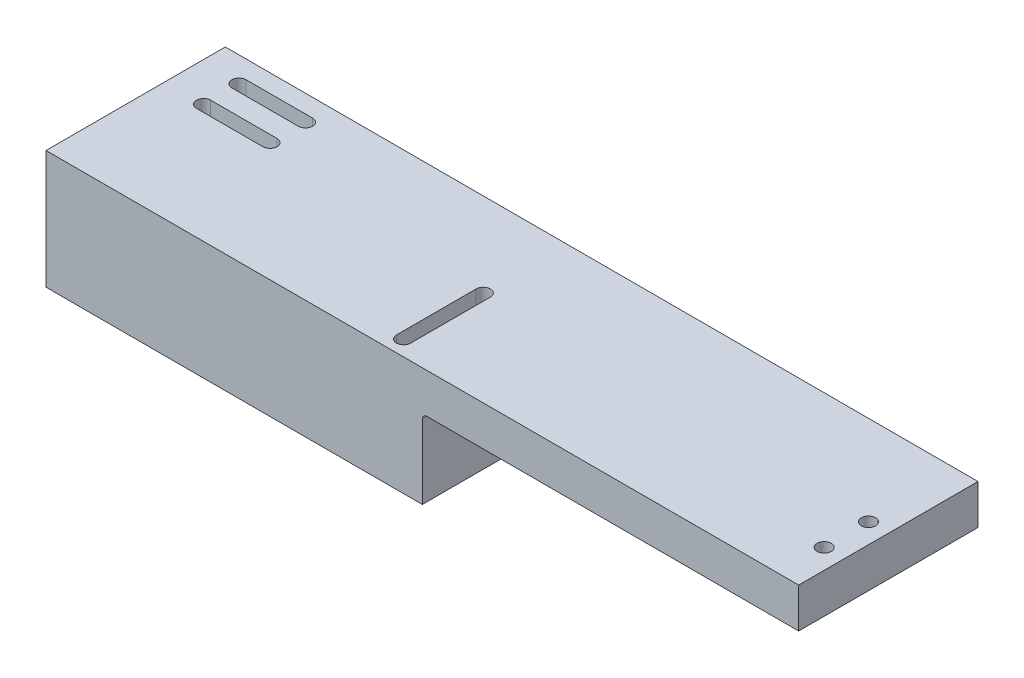
from build123d import *

# Parameters (mm, degrees)
SKETCH1_W           = 170
SKETCH1_H           = 40.5
BOSS_EXTRUDE1_DEPTH = 9
SKETCH2_W           = 85
SKETCH2_H           = 40.5
BOSS_EXTRUDE2_DEPTH = 17.745
SKETCH3_R           = 1.6
CUT_EXTRUDE1_DEPTH  = 92.380290681
FILLET1_R           = 1


with BuildPart() as part:
    # Sketch1 → Boss-Extrude1 (new body)
    with BuildSketch(Plane(origin=(0, 0, 0), x_dir=(1, 0, 0), z_dir=(0, 1, 0))):
        Rectangle(SKETCH1_W, SKETCH1_H)
    extrude(amount=BOSS_EXTRUDE1_DEPTH)

    # Sketch2 → Boss-Extrude2 (add)
    with BuildSketch(Plane.XZ):
        with Locations((-42.5, 0)):
            Rectangle(SKETCH2_W, SKETCH2_H)
    extrude(amount=BOSS_EXTRUDE2_DEPTH)

    # Sketch3 → Cut-Extrude1 (cut, through all)
    with BuildSketch(Plane(origin=(0, 9, 0), x_dir=(1, 0, 0), z_dir=(0, 1, 0))):
        with Locations(Location((80.508679868, 0, 0), (0, 0, 270))):
            Circle(SKETCH3_R)
        with Locations(Location((80.508679868, -10, 0), (0, 0, 270))):
            Circle(SKETCH3_R)
        with BuildLine():
            Line((-76.241320132, 8.185093605), (-61.241320132, 8.185093605))
            ThreePointArc((-61.241320132, 8.185093605), (-59.641320132, 6.585093605), (-61.241320132, 4.985093605))
            Line((-61.241320132, 4.985093605), (-76.241320132, 4.985093605))
            ThreePointArc((-76.241320132, 4.985093605), (-77.841320132, 6.585093605), (-76.241320132, 8.185093605))
        make_face()
        with BuildLine():
            Line((-61.241320132, 12.985093605), (-76.241320132, 12.985093605))
            ThreePointArc((-76.241320132, 12.985093605), (-77.841320132, 14.585093605), (-76.241320132, 16.185093605))
            Line((-76.241320132, 16.185093605), (-61.241320132, 16.185093605))
            ThreePointArc((-61.241320132, 16.185093605), (-59.641320132, 14.585093605), (-61.241320132, 12.985093605))
        make_face()
        with BuildLine():
            Line((-6.141320132, 1.249202664), (-6.141320132, -16.750797336))
            ThreePointArc((-6.141320132, -16.750797336), (-7.741320132, -18.350797336), (-9.341320132, -16.750797336))
            Line((-9.341320132, -16.750797336), (-9.341320132, 1.249202664))
            ThreePointArc((-9.341320132, 1.249202664), (-7.741320132, 2.849202664), (-6.141320132, 1.249202664))
        make_face()
    extrude(amount=-CUT_EXTRUDE1_DEPTH, mode=Mode.SUBTRACT)

    # Fillet1
    fillet1_edges = [part.edges().sort_by_distance(p)[0] for p in [
        (0, 0, 0),
    ]]
    fillet(fillet1_edges, radius=FILLET1_R)


solid = part.part
